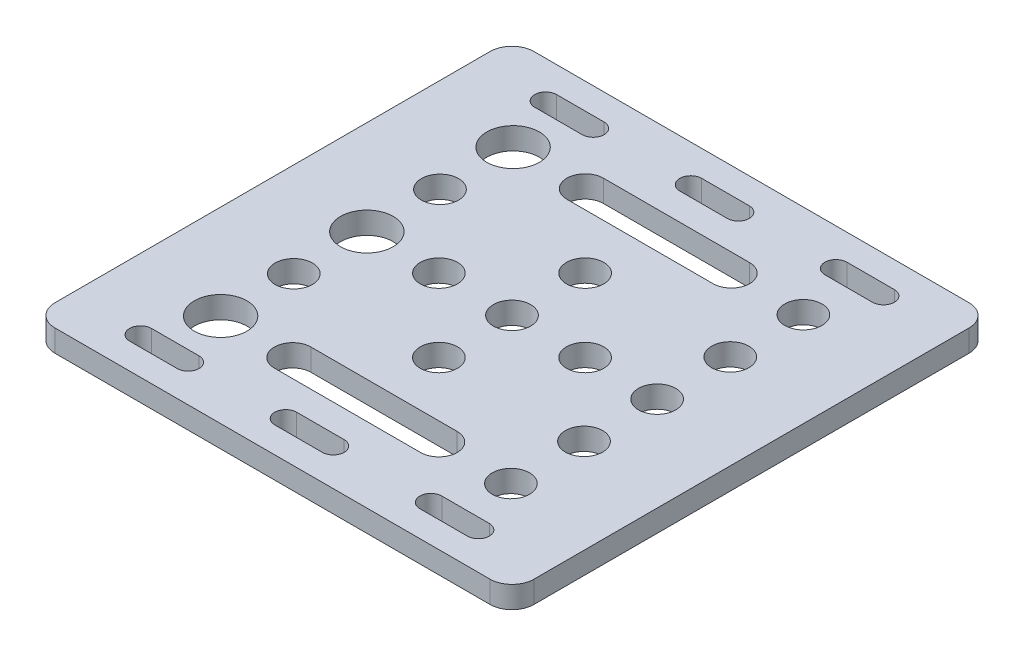
from build123d import *

# Parameters (mm, degrees)
SKETCH_1_W      = 65.5
SKETCH_1_H      = 65.5
SKETCH_1_R      = 3.6
SKETCH_1_R_2    = 2.55
EXTRUDE_1_DEPTH = 3
FILLET_1_R      = 3


with BuildPart() as part:
    # 草图1 → 凸台-拉伸1 (new body)
    with BuildSketch(Plane(origin=(0, 0, 0), x_dir=(1, 0, 0), z_dir=(0, 1, 0))):
        with Locations((32.75, -32.75)):
            Rectangle(SKETCH_1_W, SKETCH_1_H)
        with Locations(Location((12.9, -12.75, 0), (0, 0, 270))):
            Circle(SKETCH_1_R, mode=Mode.SUBTRACT)
        with Locations(Location((12.9, -32.75, 0), (0, 0, 270))):
            Circle(SKETCH_1_R, mode=Mode.SUBTRACT)
        with Locations(Location((12.9, -52.75, 0), (0, 0, 270))):
            Circle(SKETCH_1_R, mode=Mode.SUBTRACT)
        with Locations(Location((32.75, -32.75, 0), (0, 0, 270))):
            Circle(SKETCH_1_R_2, mode=Mode.SUBTRACT)
        with Locations(Location((22.75, -32.75, 0), (0, 0, 270))):
            Circle(SKETCH_1_R_2, mode=Mode.SUBTRACT)
        with Locations(Location((32.75, -22.75, 0), (0, 0, 270))):
            Circle(SKETCH_1_R_2, mode=Mode.SUBTRACT)
        with Locations(Location((32.75, -42.75, 0), (0, 0, 90))):
            Circle(SKETCH_1_R_2, mode=Mode.SUBTRACT)
        with Locations(Location((42.75, -32.75, 0), (0, 0, 90))):
            Circle(SKETCH_1_R_2, mode=Mode.SUBTRACT)
        with Locations(Location((52.6, -12.75, 0), (0, 0, 270))):
            Circle(SKETCH_1_R_2, mode=Mode.SUBTRACT)
        with Locations(Location((52.6, -22.75, 0), (0, 0, 270))):
            Circle(SKETCH_1_R_2, mode=Mode.SUBTRACT)
        with Locations(Location((52.6, -32.75, 0), (0, 0, 270))):
            Circle(SKETCH_1_R_2, mode=Mode.SUBTRACT)
        with Locations(Location((52.6, -42.75, 0), (0, 0, 270))):
            Circle(SKETCH_1_R_2, mode=Mode.SUBTRACT)
        with Locations(Location((52.6, -52.75, 0), (0, 0, 270))):
            Circle(SKETCH_1_R_2, mode=Mode.SUBTRACT)
        with Locations(Location((12.9, -42.75, 0), (0, 0, 90))):
            Circle(SKETCH_1_R_2, mode=Mode.SUBTRACT)
        with Locations(Location((12.9, -22.75, 0), (0, 0, 90))):
            Circle(SKETCH_1_R_2, mode=Mode.SUBTRACT)
        with BuildLine():
            Line((29.5, -3.55), (36, -3.55))
            ThreePointArc((36, -3.55), (37.5, -5.05), (36, -6.55))
            Line((36, -6.55), (29.5, -6.55))
            ThreePointArc((29.5, -6.55), (28, -5.05), (29.5, -3.55))
        make_face(mode=Mode.SUBTRACT)
        with BuildLine():
            Line((49.35, -3.55), (55.85, -3.55))
            ThreePointArc((55.85, -3.55), (57.35, -5.05), (55.85, -6.55))
            Line((55.85, -6.55), (49.35, -6.55))
            ThreePointArc((49.35, -6.55), (47.85, -5.05), (49.35, -3.55))
        make_face(mode=Mode.SUBTRACT)
        with BuildLine():
            Line((16.15, -3.55), (9.65, -3.55))
            ThreePointArc((9.65, -3.55), (8.15, -5.05), (9.65, -6.55))
            Line((9.65, -6.55), (16.15, -6.55))
            ThreePointArc((16.15, -6.55), (17.65, -5.05), (16.15, -3.55))
        make_face(mode=Mode.SUBTRACT)
        with BuildLine():
            Line((16.15, -61.95), (9.65, -61.95))
            ThreePointArc((9.65, -61.95), (8.15, -60.45), (9.65, -58.95))
            Line((9.65, -58.95), (16.15, -58.95))
            ThreePointArc((16.15, -58.95), (17.65, -60.45), (16.15, -61.95))
        make_face(mode=Mode.SUBTRACT)
        with BuildLine():
            Line((29.5, -61.95), (36, -61.95))
            ThreePointArc((36, -61.95), (37.5, -60.45), (36, -58.95))
            Line((36, -58.95), (29.5, -58.95))
            ThreePointArc((29.5, -58.95), (28, -60.45), (29.5, -61.95))
        make_face(mode=Mode.SUBTRACT)
        with BuildLine():
            Line((49.35, -61.95), (55.85, -61.95))
            ThreePointArc((55.85, -61.95), (57.35, -60.45), (55.85, -58.95))
            Line((55.85, -58.95), (49.35, -58.95))
            ThreePointArc((49.35, -58.95), (47.85, -60.45), (49.35, -61.95))
        make_face(mode=Mode.SUBTRACT)
        with BuildLine():
            Line((22.75, -10.25), (42.75, -10.25))
            ThreePointArc((42.75, -10.25), (45.25, -12.75), (42.75, -15.25))
            Line((42.75, -15.25), (22.75, -15.25))
            ThreePointArc((22.75, -15.25), (20.25, -12.75), (22.75, -10.25))
        make_face(mode=Mode.SUBTRACT)
        with BuildLine():
            Line((22.75, -55.25), (42.75, -55.25))
            ThreePointArc((42.75, -55.25), (45.25, -52.75), (42.75, -50.25))
            Line((42.75, -50.25), (22.75, -50.25))
            ThreePointArc((22.75, -50.25), (20.25, -52.75), (22.75, -55.25))
        make_face(mode=Mode.SUBTRACT)
    extrude(amount=EXTRUDE_1_DEPTH)

    # 圆角1
    fillet_1_edges = [part.edges().sort_by_distance(p)[0] for p in [
        (0, 1.5, 0),
        (65.5, 1.5, 0),
        (65.5, 1.5, 65.5),
        (0, 1.5, 65.5),
    ]]
    fillet(fillet_1_edges, radius=FILLET_1_R)


solid = part.part
